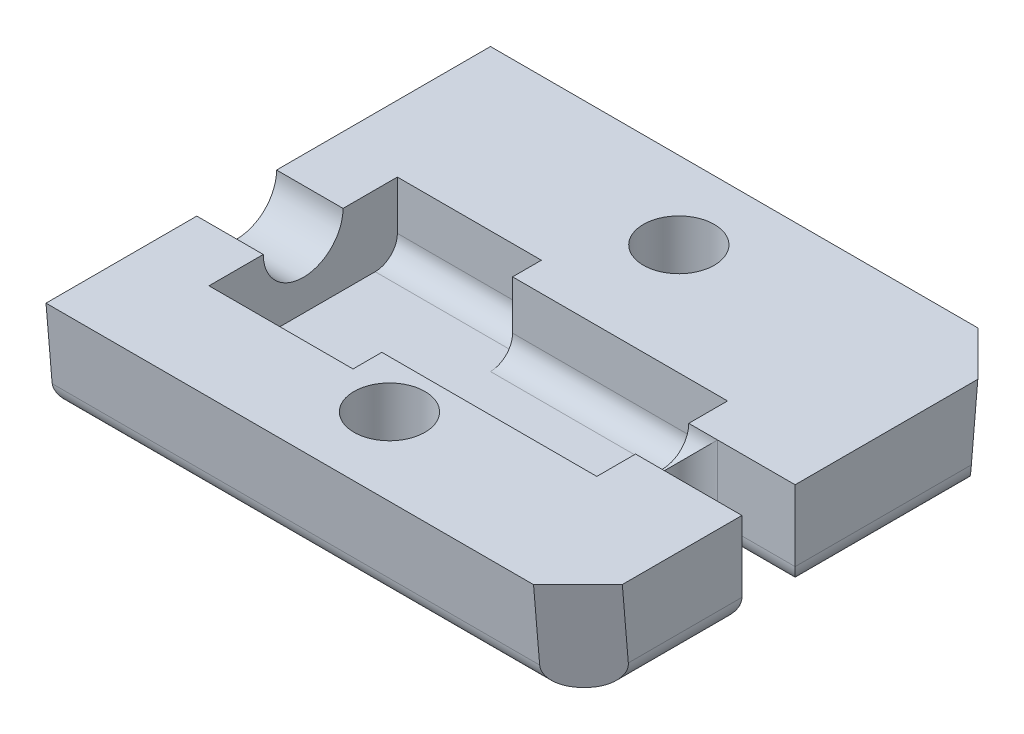
from build123d import *

# Parameters (mm, degrees)
BOSS_EXTRUDE1_DEPTH                             = 3.2
SKETCH2_W                                       = 24
SKETCH2_H                                       = 16.5
BOSS_EXTRUDE2_DEPTH                             = 1
BOSS_EXTRUDE3_DEPTH                             = 4.8
BOSS_EXTRUDE4_DEPTH                             = 3
CUT_EXTRUDE1_REACH                              = 28.659
BOSS_EXTRUDE5_DEPTH                             = 24
SKETCH7_R                                       = 1.55
CUT_EXTRUDE2_DEPTH                              = 10
CHAMFER1_SIZE                                   = 2
FILLET1_R                                       = 1
CSK_FOR_M3_FLAT_HEAD_MACHINE_SCREW1_D           = 3.2
CSK_FOR_M3_FLAT_HEAD_MACHINE_SCREW1_CSINK_D     = 6.3
CSK_FOR_M3_FLAT_HEAD_MACHINE_SCREW1_CSINK_ANGLE = 90
FILLET2_R                                       = 1


with BuildPart() as part:
    # Sketch1 → Boss-Extrude1 (new body)
    with BuildSketch(Plane(origin=(0, 0, 0), x_dir=(1, 0, 0), z_dir=(0, 1, 0))):
        Polygon((1, 8.25), (1, 1.8), (4, 1.8), (4, 4.25), (10.5, 4.25), (10.5, 2.95), (20.2, 2.95), (20.2, 1.2), (25, 1.2), (25, 8.25), align=None)
    extrude(amount=BOSS_EXTRUDE1_DEPTH)


with BuildPart() as body_2:
    # Mirror3: mirrored copy
    add(part.part.mirror(Plane.XY))


with BuildPart() as part_1:
    add(part.part)

    add(body_2.part)  # Boss-Extrude2 merges body 2
    # Sketch2 → Boss-Extrude2 (add)
    with BuildSketch(Plane.XZ):
        with Locations((13, 0)):
            Rectangle(SKETCH2_W, SKETCH2_H)
    extrude(amount=BOSS_EXTRUDE2_DEPTH)

    # Sketch4 → Boss-Extrude3 (add)
    with BuildSketch(Plane(origin=(25, 0, 0), x_dir=(0, 0, -1), z_dir=(1, 0, 0))):
        with BuildLine():
            Line((-1.2, 3.2), (-1.2, 0))
            Line((-1.2, 0), (1.2, 0))
            Line((1.2, 0), (1.2, 3.2))
            ThreePointArc((1.2, 3.2), (0, 2), (-1.2, 3.2))
        make_face()
    extrude(amount=-BOSS_EXTRUDE3_DEPTH)

    # Sketch5 → Boss-Extrude4 (add)
    with BuildSketch(Plane.ZY.offset(-1)):
        with BuildLine():
            Line((-1.8, 3.2), (-1.8, 0))
            Line((-1.8, 0), (1.8, 0))
            Line((1.8, 0), (1.8, 3.2))
            ThreePointArc((1.8, 3.2), (0, 1.4), (-1.8, 3.2))
        make_face()
    extrude(amount=-BOSS_EXTRUDE4_DEPTH)

    # Cut-Extrude1: up to this face of the body (flat: up to its plane)
    cut_extrude1_end = Plane(part_1.part.faces().sort_by_distance((13.712117152, 3.2, 5.4174866))[0])
    # Sketch6 → Cut-Extrude1 (cut, up to the picked face)
    with BuildSketch(Plane.XZ.offset(1), mode=Mode.PRIVATE) as cut_extrude1_sk1:
        with BuildLine():
            Line((21.5, 1.2), (25, 1.2))
            Line((25, 1.2), (25, -1.2))
            Line((25, -1.2), (21.5, -1.2))
            ThreePointArc((21.5, -1.2), (20.3, 0), (21.5, 1.2))
        make_face()
    cut_extrude1_tool1 = split(extrude(cut_extrude1_sk1.sketch, amount=-CUT_EXTRUDE1_REACH, mode=Mode.PRIVATE), bisect_by=cut_extrude1_end, keep=Keep.BOTH, mode=Mode.PRIVATE)
    add(cut_extrude1_tool1.solids().sort_by(Axis((22.770687, -1, 0), (0, 1, 0)))[0], mode=Mode.SUBTRACT)

    # Sketch8 → Boss-Extrude5 (add)
    with BuildSketch(Plane(origin=(25, 0, 0), x_dir=(0, 0, -1), z_dir=(1, 0, 0))):
        Polygon((-8.25, 3.2), (-8.605155295, 3.2), (-8.25, -1), align=None)
        Polygon((8.25, 3.2), (8.25, -1), (11.07, -1), (11.452307692, 3.2), align=None)
    extrude(amount=-BOSS_EXTRUDE5_DEPTH)

    # Sketch7 → Cut-Extrude2 (cut)
    with BuildSketch(Plane(origin=(0, 3.2, 0), x_dir=(1, 0, 0), z_dir=(0, 1, 0))):
        with Locations(Location((13, 7.952307692, 0), (0, 0, 270))):
            Circle(SKETCH7_R)
        with Locations(Location((13, -5.105155295, 0), (0, 0, 90))):
            Circle(SKETCH7_R)
    extrude(amount=-CUT_EXTRUDE2_DEPTH, mode=Mode.SUBTRACT)

    # Chamfer1
    chamfer1_edges = [part_1.edges().sort_by_distance(p)[0] for p in [
        (25, 1.1, 8.427577647),
        (25, 1.1, -11.261153846),
    ]]
    chamfer(chamfer1_edges, length=CHAMFER1_SIZE)

    # Fillet1
    fillet1_edges = [part_1.edges().sort_by_distance(p)[0] for p in [
        (25, -1, 3.721431105),
        (20.3, -1, 0),
        (23.25, -1, -1.2),
        (23.25, -1, 1.2),
        (12, -1, -11.07),
        (12, -1, 8.25),
        (25, -1, -5.130865713),
        (1, -1, -1.41),
    ]]
    fillet(fillet1_edges, radius=FILLET1_R)

    # CSK for M3 Flat Head Machine Screw1 (through all)
    with Locations(Plane(origin=(0, -1, 0), x_dir=(-1, 0, 0), z_dir=(0, -1, 0))):
        with Locations((-13, -5.105155295), (-13, 7.952307692)):
            CounterSinkHole(CSK_FOR_M3_FLAT_HEAD_MACHINE_SCREW1_D / 2, CSK_FOR_M3_FLAT_HEAD_MACHINE_SCREW1_CSINK_D / 2, counter_sink_angle=CSK_FOR_M3_FLAT_HEAD_MACHINE_SCREW1_CSINK_ANGLE)

    # Fillet2
    fillet2_edges = [part_1.edges().sort_by_distance(p)[0] for p in [
        (15.35, 0, -2.95),
        (7.25, 0, -4.25),
        (15.35, 0, 2.95),
        (7.25, 0, 4.25),
    ]]
    fillet(fillet2_edges, radius=FILLET2_R)


solid = part_1.part
